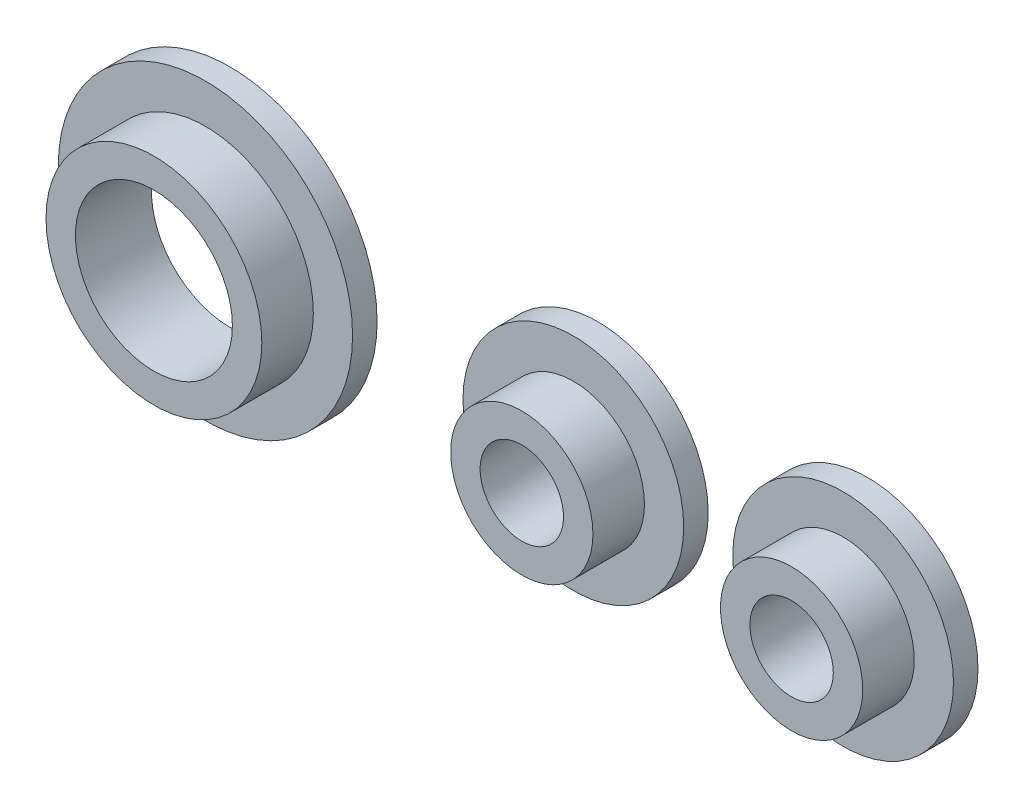
from build123d import *

# Parameters (mm, degrees)
SKETCH1_R              = 12
LIPS_DEPTH             = 2
SKETCH1_R_2            = 9
LIPS_2_DEPTH           = 2
LIPS_3_DEPTH           = 2
SKETCH2_R              = 8.8
SKETCH2_R_2            = 5.8
NECKS_DEPTH            = 4.2
CABLE_BORES_DEPTH      = 63.477515956
CABLE_BORES_DEPTH_BACK = 63.477515956
SKETCH3_R              = 6.4
SKETCH3_R_2            = 3.4


with BuildPart() as part:
    # Sketch1 → Lips (new body)
    with BuildSketch(Plane.XY):
        Circle(SKETCH1_R)
    extrude(amount=LIPS_DEPTH)



with BuildPart() as body_2:
    # Sketch1 → Lips 2 (new body)
    with BuildSketch(Plane.XY):
        with Locations((30, 0)):
            Circle(SKETCH1_R_2)
    extrude(amount=LIPS_2_DEPTH)


with BuildPart() as body_3:
    # Sketch1 → Lips 3 (new body)
    with BuildSketch(Plane.XY):
        with Locations((52, 0)):
            Circle(SKETCH1_R_2)
    extrude(amount=LIPS_3_DEPTH)


with BuildPart() as part_1:
    add(part.part)

    add(body_2.part)  # Necks merges body 2

    add(body_3.part)  # Necks merges body 3
    # Sketch2 → Necks (add)
    with BuildSketch(Plane.XY.offset(2)):
        Circle(SKETCH2_R)
        with Locations((30, 0)):
            Circle(SKETCH2_R_2)
        with Locations((52, 0)):
            Circle(SKETCH2_R_2)
    extrude(amount=NECKS_DEPTH)

    # Sketch3 → Cable_bores (cut, two sides: drawn at the far end of the back side and taken through both)
    with BuildSketch(Plane.XY.offset(-CABLE_BORES_DEPTH_BACK)):
        Circle(SKETCH3_R)
        with Locations((30, 0)):
            Circle(SKETCH3_R_2)
        with Locations((52, 0)):
            Circle(SKETCH3_R_2)
    extrude(amount=CABLE_BORES_DEPTH + CABLE_BORES_DEPTH_BACK, mode=Mode.SUBTRACT)


solid = part_1.part
